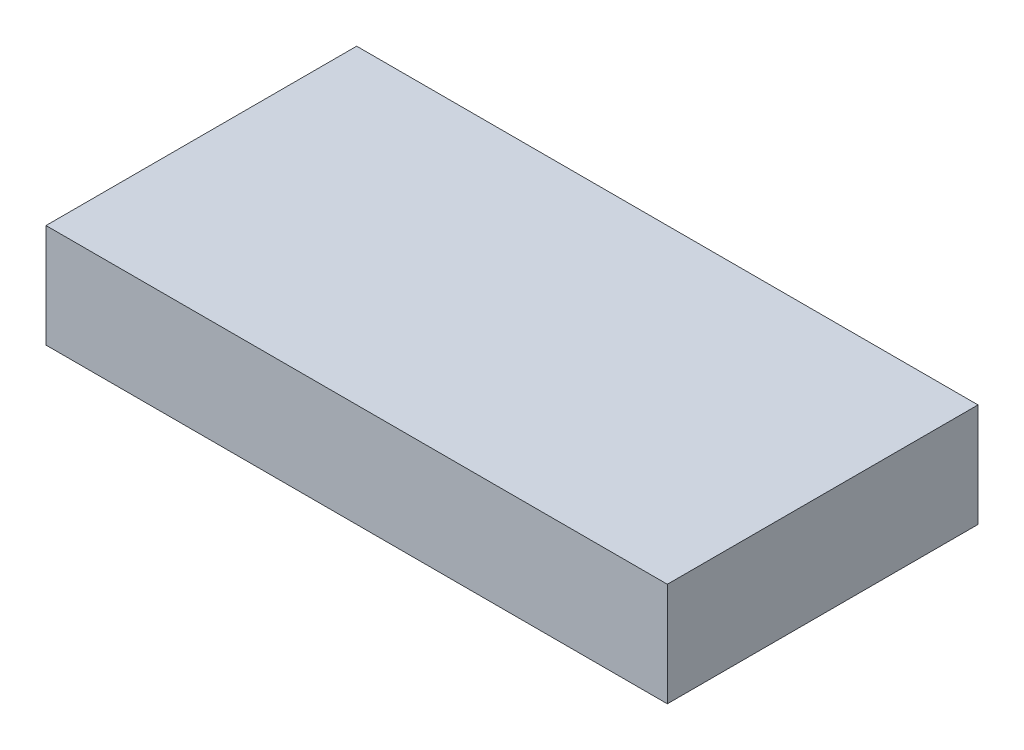
from build123d import *

# Parameters (mm, degrees)
SKETCH1_W           = 24
SKETCH1_H           = 12
BOSS_EXTRUDE1_DEPTH = 4


with BuildPart() as part:
    # Sketch1 → Boss-Extrude1 (new body)
    with BuildSketch(Plane(origin=(0, 0, 0), x_dir=(1, 0, 0), z_dir=(0, 1, 0))):
        with Locations((1.318309859, -1.030985915)):
            Rectangle(SKETCH1_W, SKETCH1_H)
    extrude(amount=BOSS_EXTRUDE1_DEPTH)


solid = part.part
